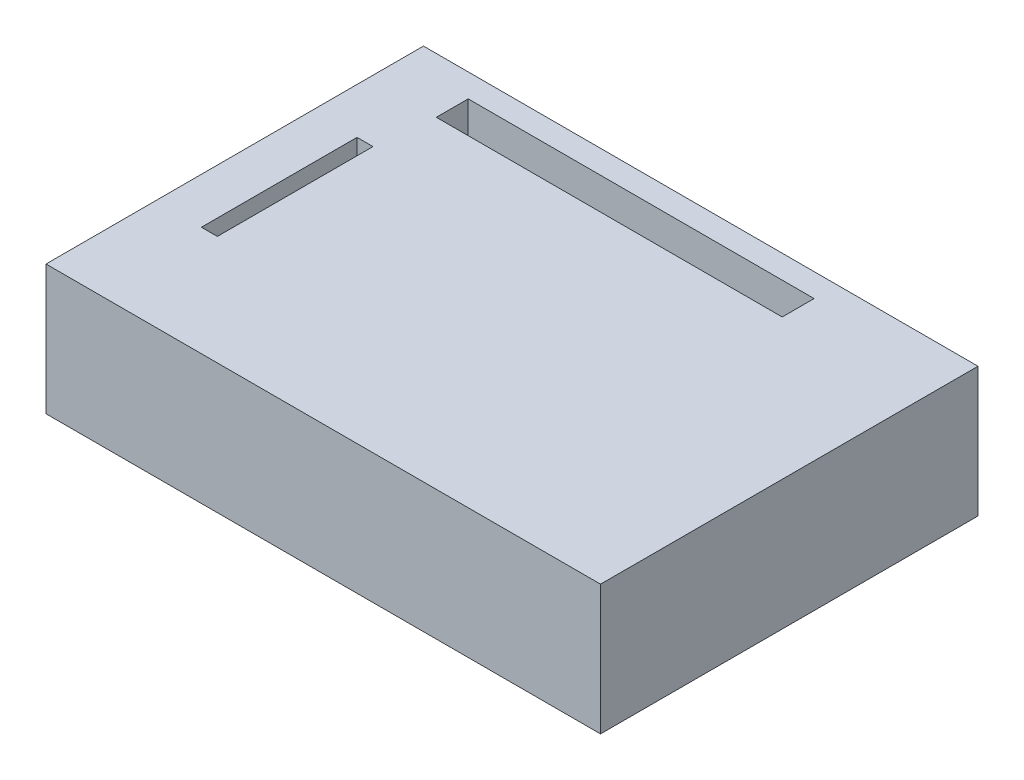
from build123d import *

# Parameters (mm, degrees)
SKETCH1_W           = 85.5
SKETCH1_H           = 58.2
SKETCH1_W_2         = 2.46
SKETCH1_H_2         = 24
SKETCH1_W_3         = 53.33
SKETCH1_H_3         = 4.92
BOSS_EXTRUDE1_DEPTH = 20


with BuildPart() as part:
    # Sketch1 → Boss-Extrude1 (new body)
    with BuildSketch(Plane(origin=(0, 0, 0), x_dir=(1, 0, 0), z_dir=(0, 1, 0))):
        with Locations((42.75, -29.1)):
            Rectangle(SKETCH1_W, SKETCH1_H)
        with Locations((8.3, -29.31)):
            Rectangle(SKETCH1_W_2, SKETCH1_H_2, mode=Mode.SUBTRACT)
        with Locations((37.165, -6.06)):
            Rectangle(SKETCH1_W_3, SKETCH1_H_3, mode=Mode.SUBTRACT)
    extrude(amount=BOSS_EXTRUDE1_DEPTH)


solid = part.part
